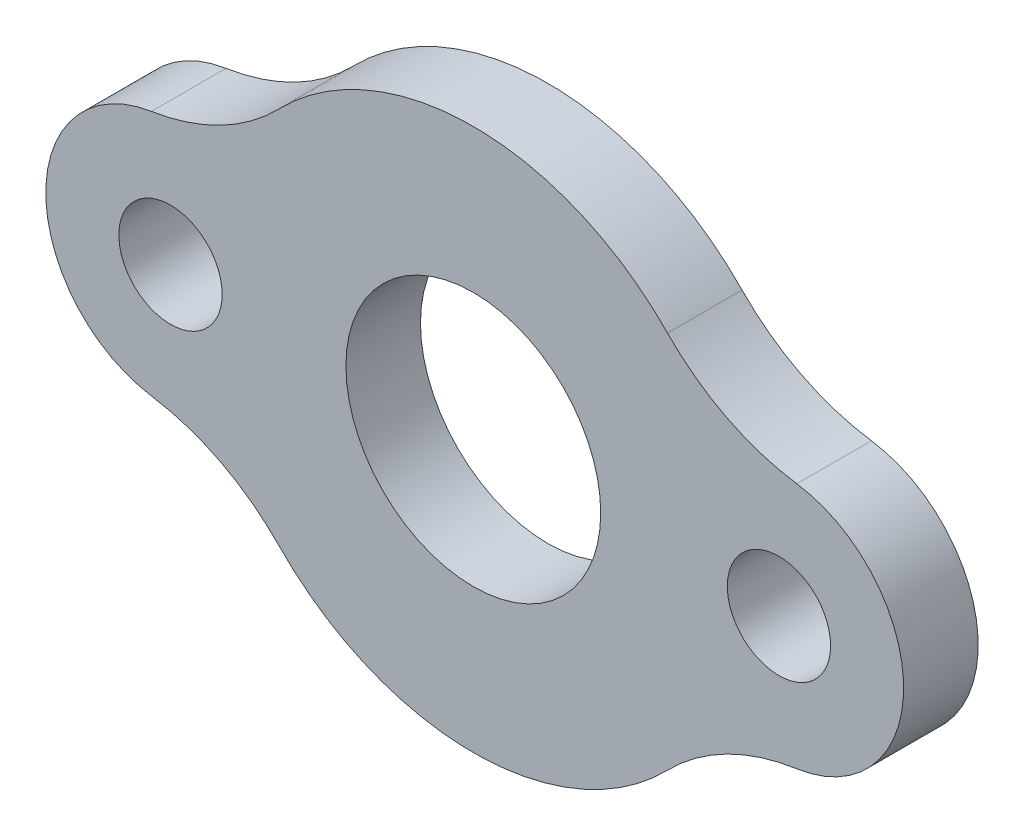
from build123d import *

# Parameters (mm, degrees)
ESBO_O1_R                = 1.143
ESBO_O1_R_2              = 2.819211747
RESSALTO_EXTRUS_O1_DEPTH = 1.65


with BuildPart() as part:
    # Esboço1 → Ressalto-extrusão1 (new body)
    with BuildSketch(Plane.XY):
        with BuildLine():
            ThreePointArc((-4.302124406, -4.182311163), (-4.077931794, -4.401189993), (-3.842618859, -4.608066989))
            ThreePointArc((-3.842618859, -4.608066989), (0, -6.000000089), (3.842618859, -4.608066989))
            ThreePointArc((3.842618859, -4.608066989), (4.074890318, -4.404006128), (4.296341713, -4.188251301))
            ThreePointArc((4.296341713, -4.188251301), (5.607085842, -3.223218185), (7.158341274, -2.730322991))
            ThreePointArc((7.158341274, -2.730322991), (9.52094015, 0), (7.158341274, 2.730322991))
            ThreePointArc((7.158341274, 2.730322991), (5.607085842, 3.223218185), (4.296341713, 4.188251301))
            ThreePointArc((4.296341713, 4.188251301), (4.077931794, 4.401189993), (3.848982033, 4.602753348))
            ThreePointArc((3.848982033, 4.602753348), (0.008290039, 5.999994362), (-3.836248349, 4.613371834))
            ThreePointArc((-3.836248349, 4.613371834), (-4.074890318, 4.404006128), (-4.302124406, 4.182311163))
            ThreePointArc((-4.302124406, 4.182311163), (-5.593565523, 3.224698333), (-7.12215689, 2.726450484))
            ThreePointArc((-7.12215689, 2.726450484), (-9.458939648, 0), (-7.12215689, -2.726450484))
            ThreePointArc((-7.12215689, -2.726450484), (-5.593565523, -3.224698333), (-4.302124406, -4.182311163))
        make_face()
        with Locations((6.76200015, 0)):
            Circle(ESBO_O1_R, mode=Mode.SUBTRACT)
        with Locations((-6.69999985, 0)):
            Circle(ESBO_O1_R, mode=Mode.SUBTRACT)
        Circle(ESBO_O1_R_2, mode=Mode.SUBTRACT)
    extrude(amount=RESSALTO_EXTRUS_O1_DEPTH)


solid = part.part
